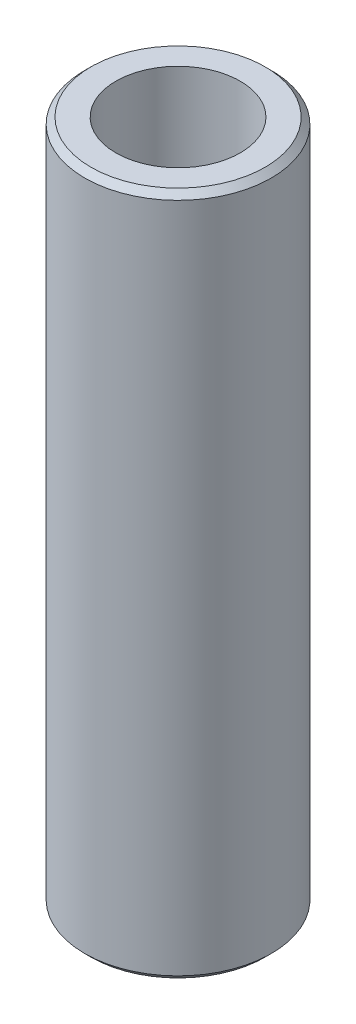
from build123d import *

# Parameters (mm, degrees)
SKETCH1_R            = 7.5
SKETCH1_R_2          = 5
CORPO_15_55_DEPTH    = 55
CHANFROS_0_5_45_SIZE = 0.5


with BuildPart() as part:
    # Sketch1 → Corpo Ø15×55 (new body)
    with BuildSketch(Plane(origin=(0, 0, 0), x_dir=(1, 0, 0), z_dir=(0, 1, 0))):
        with Locations(Location((0, 0, 0), (0, 0, 270))):
            Circle(SKETCH1_R)
        with Locations(Location((0, 0, 0), (0, 0, 270))):
            Circle(SKETCH1_R_2, mode=Mode.SUBTRACT)
    extrude(amount=CORPO_15_55_DEPTH)

    # Chanfros 0.5×45°
    chanfros_0_5_45_edges = [part.edges().sort_by_distance(p)[0] for p in [
        (0, 0, -7.5),
        (0, 55, -7.5),
    ]]
    chamfer(chanfros_0_5_45_edges, length=CHANFROS_0_5_45_SIZE)


solid = part.part
